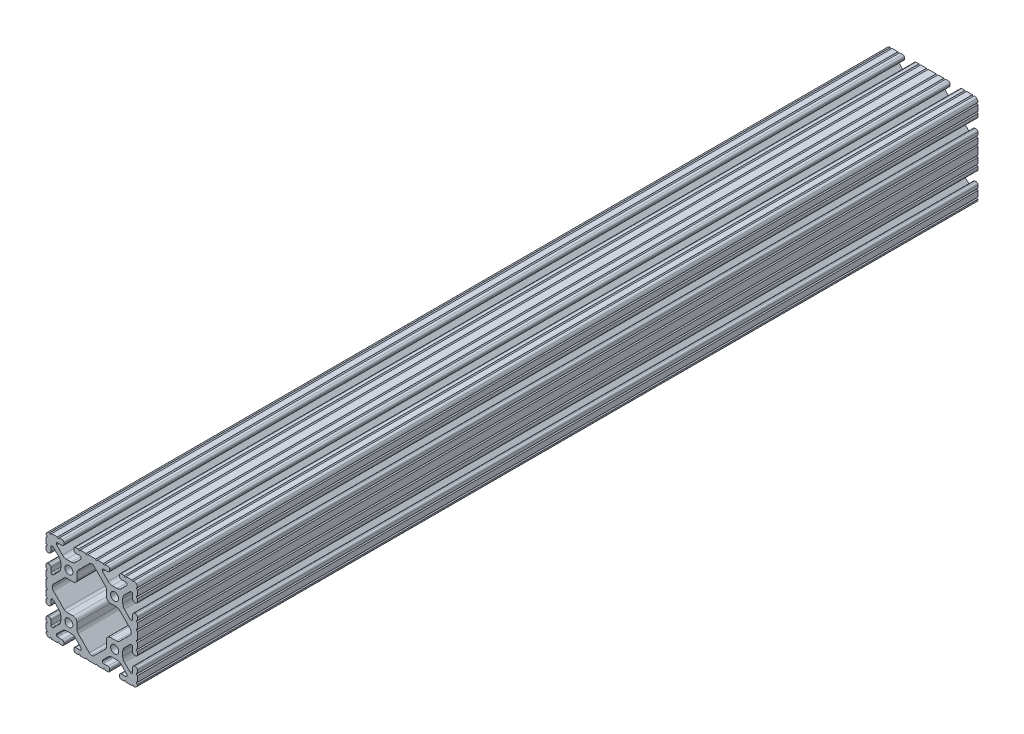
from build123d import *

# Parameters (mm, degrees)
BOSS_EXTRUDE1_DEPTH      = 350
BOSS_EXTRUDE1_DEPTH_BACK = 350
SKETCH3_R                = 3.3274


with BuildPart() as part:
    # Sketch3 → Boss-Extrude1 (new, two sides: drawn at the far end of the back side and taken through both)
    with BuildSketch(Plane.XY.offset(-BOSS_EXTRUDE1_DEPTH_BACK)):
        with BuildLine():
            Line((34.036, 28.448), (34.036, 24.630196049))
            ThreePointArc((34.036, 24.630196049), (34.497248241, 23.51664429), (35.6108, 23.055396049))
            Line((35.6108, 23.055396049), (36.525200183, 23.055396049))
            ThreePointArc((36.525200183, 23.055396049), (37.638751813, 23.516644236), (38.1, 24.630195866))
            Line((38.1, 24.630195866), (38.1, 27.023826138))
            ThreePointArc((38.1, 27.023826138), (37.117780706, 27.7845421), (38.1, 28.545258062))
            Line((38.1, 28.545258062), (38.1, 33.373016026))
            ThreePointArc((38.1, 33.373016026), (37.141472621, 34.109236774), (38.1, 34.845457521))
            ThreePointArc((38.1, 34.845457521), (37.837757813, 36.120195002), (37.086123144, 37.182631793))
            ThreePointArc((37.086123144, 37.182631793), (36.106286572, 37.843374398), (34.952681874, 38.1))
            ThreePointArc((34.952681874, 38.1), (34.190730434, 37.320215335), (33.428778994, 38.1))
            Line((33.428778994, 38.1), (28.601105935, 38.1))
            ThreePointArc((28.601105935, 38.1), (27.839158581, 37.32021942), (27.077211227, 38.1))
            Line((27.077211227, 38.1), (24.6888, 38.1))
            ThreePointArc((24.6888, 38.1), (23.575248241, 37.638751759), (23.114, 36.5252))
            Line((23.114, 36.5252), (23.114, 35.6108))
            ThreePointArc((23.114, 35.6108), (23.575248241, 34.497248241), (24.6888, 34.036))
            Line((24.6888, 34.036), (28.448, 34.036))
            ThreePointArc((28.448, 34.036), (29.076617928, 33.775617928), (29.337, 33.147))
            Line((29.337, 33.147), (29.337, 32.720693454))
            ThreePointArc((29.337, 32.720693454), (29.326675076, 32.273872751), (29.100231244, 31.888543625))
            Line((29.100231244, 31.888543625), (24.409287499, 27.197588341))
            ThreePointArc((24.409287499, 27.197588341), (22.868340045, 26.167958114), (21.050667579, 25.8064))
            Line((21.050667579, 25.8064), (17.049332421, 25.8064))
            ThreePointArc((17.049332421, 25.8064), (15.231659955, 26.167958114), (13.690712501, 27.197588341))
            Line((13.690712501, 27.197588341), (9.023381298, 31.864931024))
            ThreePointArc((9.023381298, 31.864931024), (8.830670886, 32.153343113), (8.763, 32.493548179))
            Line((8.763, 32.493548179), (8.763, 33.147))
            ThreePointArc((8.763, 33.147), (9.023382072, 33.775617928), (9.652, 34.036))
            Line((9.652, 34.036), (13.4112, 34.036))
            ThreePointArc((13.4112, 34.036), (14.524751759, 34.497248241), (14.986, 35.6108))
            Line((14.986, 35.6108), (14.986, 36.5252))
            ThreePointArc((14.986, 36.5252), (14.524751759, 37.638751759), (13.4112, 38.1))
            Line((13.4112, 38.1), (11.128867074, 38.1))
            ThreePointArc((11.128867074, 38.1), (10.367071033, 37.320370693), (9.605274992, 38.1))
            Line((9.605274992, 38.1), (4.777313069, 38.1))
            ThreePointArc((4.777313069, 38.1), (4.015517029, 37.320370693), (3.253720988, 38.1))
            Line((3.253720988, 38.1), (-3.253720988, 38.1))
            ThreePointArc((-3.253720988, 38.1), (-4.015517029, 37.320370693), (-4.777313069, 38.1))
            Line((-4.777313069, 38.1), (-9.605274992, 38.1))
            ThreePointArc((-9.605274992, 38.1), (-10.367071033, 37.320370693), (-11.128867074, 38.1))
            Line((-11.128867074, 38.1), (-13.4112, 38.1))
            ThreePointArc((-13.4112, 38.1), (-14.524751759, 37.638751759), (-14.986, 36.5252))
            Line((-14.986, 36.5252), (-14.986, 35.6108))
            ThreePointArc((-14.986, 35.6108), (-14.524751759, 34.497248241), (-13.4112, 34.036))
            Line((-13.4112, 34.036), (-9.652, 34.036))
            ThreePointArc((-9.652, 34.036), (-9.023382072, 33.775617928), (-8.763, 33.147))
            Line((-8.763, 33.147), (-8.763, 32.493548179))
            ThreePointArc((-8.763, 32.493548179), (-8.830670886, 32.153343113), (-9.023381298, 31.864931024))
            Line((-9.023381298, 31.864931024), (-13.690712501, 27.197588341))
            ThreePointArc((-13.690712501, 27.197588341), (-15.231659955, 26.167958114), (-17.049332421, 25.8064))
            Line((-17.049332421, 25.8064), (-21.050667579, 25.8064))
            ThreePointArc((-21.050667579, 25.8064), (-22.868340045, 26.167958114), (-24.409287499, 27.197588341))
            Line((-24.409287499, 27.197588341), (-29.100231244, 31.888543625))
            ThreePointArc((-29.100231244, 31.888543625), (-29.326675076, 32.273872751), (-29.337, 32.720693454))
            Line((-29.337, 32.720693454), (-29.337, 33.147))
            ThreePointArc((-29.337, 33.147), (-29.076617928, 33.775617928), (-28.448, 34.036))
            Line((-28.448, 34.036), (-24.6888, 34.036))
            ThreePointArc((-24.6888, 34.036), (-23.575248241, 34.497248241), (-23.114, 35.6108))
            Line((-23.114, 35.6108), (-23.114, 36.5252))
            ThreePointArc((-23.114, 36.5252), (-23.575248241, 37.638751759), (-24.6888, 38.1))
            Line((-24.6888, 38.1), (-27.077211227, 38.1))
            ThreePointArc((-27.077211227, 38.1), (-27.839158581, 37.32021942), (-28.601105935, 38.1))
            Line((-28.601105935, 38.1), (-33.428778994, 38.1))
            ThreePointArc((-33.428778994, 38.1), (-34.190730434, 37.320215335), (-34.952681874, 38.1))
            ThreePointArc((-34.952681874, 38.1), (-36.106286572, 37.843374398), (-37.086123144, 37.182631793))
            ThreePointArc((-37.086123144, 37.182631793), (-37.837757813, 36.120195002), (-38.1, 34.845457521))
            ThreePointArc((-38.1, 34.845457521), (-37.141472621, 34.109236774), (-38.1, 33.373016026))
            Line((-38.1, 33.373016026), (-38.1, 28.545258062))
            ThreePointArc((-38.1, 28.545258062), (-37.117780706, 27.7845421), (-38.1, 27.023826138))
            Line((-38.1, 27.023826138), (-38.1, 24.630195866))
            ThreePointArc((-38.1, 24.630195866), (-37.638751813, 23.516644236), (-36.525200183, 23.055396049))
            Line((-36.525200183, 23.055396049), (-35.6108, 23.055396049))
            ThreePointArc((-35.6108, 23.055396049), (-34.497248241, 23.51664429), (-34.036, 24.630196049))
            Line((-34.036, 24.630196049), (-34.036, 28.448))
            ThreePointArc((-34.036, 28.448), (-33.775617928, 29.076617928), (-33.147, 29.337))
            Line((-33.147, 29.337), (-32.664287242, 29.337))
            ThreePointArc((-32.664287242, 29.337), (-32.324081166, 29.269328695), (-32.03566854, 29.076617155))
            Line((-32.03566854, 29.076617155), (-27.19758008, 24.238516795))
            ThreePointArc((-27.19758008, 24.238516795), (-26.167955879, 22.697572205), (-25.8064, 20.879905136))
            Line((-25.8064, 20.879905136), (-25.8064, 17.220094864))
            ThreePointArc((-25.8064, 17.220094864), (-26.167955879, 15.402427795), (-27.19758008, 13.861483205))
            Line((-27.19758008, 13.861483205), (-31.948944541, 9.110107057))
            ThreePointArc((-31.948944541, 9.110107057), (-32.333417096, 8.853210196), (-32.786933649, 8.763))
            Line((-32.786933649, 8.763), (-33.060275787, 8.763))
            ThreePointArc((-33.060275787, 8.763), (-33.750216995, 9.048783005), (-34.036, 9.738724213))
            Line((-34.036, 9.738724213), (-34.036, 13.469803585))
            ThreePointArc((-34.036, 13.469803585), (-34.497248348, 14.583355603), (-35.610800366, 15.044603951))
            Line((-35.610800366, 15.044603951), (-36.5252, 15.044603951))
            ThreePointArc((-36.5252, 15.044603951), (-37.638751759, 14.58335571), (-38.1, 13.469803951))
            Line((-38.1, 13.469803951), (-38.1, 11.075039289))
            ThreePointArc((-38.1, 11.075039289), (-37.117000248, 10.313517272), (-38.1, 9.551995255))
            Line((-38.1, 9.551995255), (-38.1, 4.723759308))
            ThreePointArc((-38.1, 4.723759308), (-37.117000248, 3.962237292), (-38.1, 3.200715275))
            Line((-38.1, 3.200715275), (-38.1, -3.200715275))
            ThreePointArc((-38.1, -3.200715275), (-37.117000248, -3.962237292), (-38.1, -4.723759308))
            Line((-38.1, -4.723759308), (-38.1, -9.551995255))
            ThreePointArc((-38.1, -9.551995255), (-37.117000248, -10.313517272), (-38.1, -11.075039289))
            Line((-38.1, -11.075039289), (-38.1, -13.469803951))
            ThreePointArc((-38.1, -13.469803951), (-37.638751759, -14.58335571), (-36.5252, -15.044603951))
            Line((-36.5252, -15.044603951), (-35.610800366, -15.044603951))
            ThreePointArc((-35.610800366, -15.044603951), (-34.497248348, -14.583355603), (-34.036, -13.469803585))
            Line((-34.036, -13.469803585), (-34.036, -9.738724213))
            ThreePointArc((-34.036, -9.738724213), (-33.750216995, -9.048783005), (-33.060275787, -8.763))
            Line((-33.060275787, -8.763), (-32.786933649, -8.763))
            ThreePointArc((-32.786933649, -8.763), (-32.333417096, -8.853210196), (-31.948944541, -9.110107057))
            Line((-31.948944541, -9.110107057), (-27.19758008, -13.861483205))
            ThreePointArc((-27.19758008, -13.861483205), (-26.167955879, -15.402427795), (-25.8064, -17.220094864))
            Line((-25.8064, -17.220094864), (-25.8064, -20.879905136))
            ThreePointArc((-25.8064, -20.879905136), (-26.167955879, -22.697572205), (-27.19758008, -24.238516795))
            Line((-27.19758008, -24.238516795), (-32.03566854, -29.076617155))
            ThreePointArc((-32.03566854, -29.076617155), (-32.324081166, -29.269328695), (-32.664287242, -29.337))
            Line((-32.664287242, -29.337), (-33.147, -29.337))
            ThreePointArc((-33.147, -29.337), (-33.775617928, -29.076617928), (-34.036, -28.448))
            Line((-34.036, -28.448), (-34.036, -24.630196049))
            ThreePointArc((-34.036, -24.630196049), (-34.497248241, -23.51664429), (-35.6108, -23.055396049))
            Line((-35.6108, -23.055396049), (-36.525200183, -23.055396049))
            ThreePointArc((-36.525200183, -23.055396049), (-37.638751813, -23.516644236), (-38.1, -24.630195866))
            Line((-38.1, -24.630195866), (-38.1, -27.023826138))
            ThreePointArc((-38.1, -27.023826138), (-37.117780706, -27.7845421), (-38.1, -28.545258062))
            Line((-38.1, -28.545258062), (-38.1, -33.373016026))
            ThreePointArc((-38.1, -33.373016026), (-37.141472621, -34.109236774), (-38.1, -34.845457521))
            ThreePointArc((-38.1, -34.845457521), (-37.837757813, -36.120195002), (-37.086123144, -37.182631793))
            ThreePointArc((-37.086123144, -37.182631793), (-36.106286572, -37.843374398), (-34.952681874, -38.1))
            ThreePointArc((-34.952681874, -38.1), (-34.190730434, -37.320215335), (-33.428778994, -38.1))
            Line((-33.428778994, -38.1), (-28.601105935, -38.1))
            ThreePointArc((-28.601105935, -38.1), (-27.839158581, -37.32021942), (-27.077211227, -38.1))
            Line((-27.077211227, -38.1), (-24.6888, -38.1))
            ThreePointArc((-24.6888, -38.1), (-23.575248241, -37.638751759), (-23.114, -36.5252))
            Line((-23.114, -36.5252), (-23.114, -35.6108))
            ThreePointArc((-23.114, -35.6108), (-23.575248241, -34.497248241), (-24.6888, -34.036))
            Line((-24.6888, -34.036), (-28.448, -34.036))
            ThreePointArc((-28.448, -34.036), (-29.076617928, -33.775617928), (-29.337, -33.147))
            Line((-29.337, -33.147), (-29.337, -32.720693454))
            ThreePointArc((-29.337, -32.720693454), (-29.326675076, -32.273872751), (-29.100231244, -31.888543625))
            Line((-29.100231244, -31.888543625), (-24.409287499, -27.197588341))
            ThreePointArc((-24.409287499, -27.197588341), (-22.868340045, -26.167958114), (-21.050667579, -25.8064))
            Line((-21.050667579, -25.8064), (-17.049332421, -25.8064))
            ThreePointArc((-17.049332421, -25.8064), (-15.231659955, -26.167958114), (-13.690712501, -27.197588341))
            Line((-13.690712501, -27.197588341), (-9.023381298, -31.864931024))
            ThreePointArc((-9.023381298, -31.864931024), (-8.830670886, -32.153343113), (-8.763, -32.493548179))
            Line((-8.763, -32.493548179), (-8.763, -33.147))
            ThreePointArc((-8.763, -33.147), (-9.023382072, -33.775617928), (-9.652, -34.036))
            Line((-9.652, -34.036), (-13.4112, -34.036))
            ThreePointArc((-13.4112, -34.036), (-14.524751759, -34.497248241), (-14.986, -35.6108))
            Line((-14.986, -35.6108), (-14.986, -36.5252))
            ThreePointArc((-14.986, -36.5252), (-14.524751759, -37.638751759), (-13.4112, -38.1))
            Line((-13.4112, -38.1), (-11.128867074, -38.1))
            ThreePointArc((-11.128867074, -38.1), (-10.367071033, -37.320370693), (-9.605274992, -38.1))
            Line((-9.605274992, -38.1), (-4.777313069, -38.1))
            ThreePointArc((-4.777313069, -38.1), (-4.015517029, -37.320370693), (-3.253720988, -38.1))
            Line((-3.253720988, -38.1), (3.253720988, -38.1))
            ThreePointArc((3.253720988, -38.1), (4.015517029, -37.320370693), (4.777313069, -38.1))
            Line((4.777313069, -38.1), (9.605274992, -38.1))
            ThreePointArc((9.605274992, -38.1), (10.367071033, -37.320370693), (11.128867074, -38.1))
            Line((11.128867074, -38.1), (13.4112, -38.1))
            ThreePointArc((13.4112, -38.1), (14.524751759, -37.638751759), (14.986, -36.5252))
            Line((14.986, -36.5252), (14.986, -35.6108))
            ThreePointArc((14.986, -35.6108), (14.524751759, -34.497248241), (13.4112, -34.036))
            Line((13.4112, -34.036), (9.652, -34.036))
            ThreePointArc((9.652, -34.036), (9.023382072, -33.775617928), (8.763, -33.147))
            Line((8.763, -33.147), (8.763, -32.493548179))
            ThreePointArc((8.763, -32.493548179), (8.830670886, -32.153343113), (9.023381298, -31.864931024))
            Line((9.023381298, -31.864931024), (13.690712501, -27.197588341))
            ThreePointArc((13.690712501, -27.197588341), (15.231659955, -26.167958114), (17.049332421, -25.8064))
            Line((17.049332421, -25.8064), (21.050667579, -25.8064))
            ThreePointArc((21.050667579, -25.8064), (22.868340045, -26.167958114), (24.409287499, -27.197588341))
            Line((24.409287499, -27.197588341), (29.100231244, -31.888543625))
            ThreePointArc((29.100231244, -31.888543625), (29.326675076, -32.273872751), (29.337, -32.720693454))
            Line((29.337, -32.720693454), (29.337, -33.147))
            ThreePointArc((29.337, -33.147), (29.076617928, -33.775617928), (28.448, -34.036))
            Line((28.448, -34.036), (24.6888, -34.036))
            ThreePointArc((24.6888, -34.036), (23.575248241, -34.497248241), (23.114, -35.6108))
            Line((23.114, -35.6108), (23.114, -36.5252))
            ThreePointArc((23.114, -36.5252), (23.575248241, -37.638751759), (24.6888, -38.1))
            Line((24.6888, -38.1), (27.077211227, -38.1))
            ThreePointArc((27.077211227, -38.1), (27.839158581, -37.32021942), (28.601105935, -38.1))
            Line((28.601105935, -38.1), (33.428778994, -38.1))
            ThreePointArc((33.428778994, -38.1), (34.190730434, -37.320215335), (34.952681874, -38.1))
            ThreePointArc((34.952681874, -38.1), (36.106286572, -37.843374398), (37.086123144, -37.182631793))
            ThreePointArc((37.086123144, -37.182631793), (37.837757813, -36.120195002), (38.1, -34.845457521))
            ThreePointArc((38.1, -34.845457521), (37.141472621, -34.109236774), (38.1, -33.373016026))
            Line((38.1, -33.373016026), (38.1, -28.545258062))
            ThreePointArc((38.1, -28.545258062), (37.117780706, -27.7845421), (38.1, -27.023826138))
            Line((38.1, -27.023826138), (38.1, -24.630195866))
            ThreePointArc((38.1, -24.630195866), (37.638751813, -23.516644236), (36.525200183, -23.055396049))
            Line((36.525200183, -23.055396049), (35.6108, -23.055396049))
            ThreePointArc((35.6108, -23.055396049), (34.497248241, -23.51664429), (34.036, -24.630196049))
            Line((34.036, -24.630196049), (34.036, -28.448))
            ThreePointArc((34.036, -28.448), (33.775617928, -29.076617928), (33.147, -29.337))
            Line((33.147, -29.337), (32.664287242, -29.337))
            ThreePointArc((32.664287242, -29.337), (32.324081166, -29.269328695), (32.03566854, -29.076617155))
            Line((32.03566854, -29.076617155), (27.19758008, -24.238516795))
            ThreePointArc((27.19758008, -24.238516795), (26.167955879, -22.697572205), (25.8064, -20.879905136))
            Line((25.8064, -20.879905136), (25.8064, -17.220094864))
            ThreePointArc((25.8064, -17.220094864), (26.167955879, -15.402427795), (27.19758008, -13.861483205))
            Line((27.19758008, -13.861483205), (31.948944541, -9.110107057))
            ThreePointArc((31.948944541, -9.110107057), (32.333417096, -8.853210196), (32.786933649, -8.763))
            Line((32.786933649, -8.763), (33.060275787, -8.763))
            ThreePointArc((33.060275787, -8.763), (33.750216995, -9.048783005), (34.036, -9.738724213))
            Line((34.036, -9.738724213), (34.036, -13.469803585))
            ThreePointArc((34.036, -13.469803585), (34.497248348, -14.583355603), (35.610800366, -15.044603951))
            Line((35.610800366, -15.044603951), (36.5252, -15.044603951))
            ThreePointArc((36.5252, -15.044603951), (37.638751759, -14.58335571), (38.1, -13.469803951))
            Line((38.1, -13.469803951), (38.1, -11.075039289))
            ThreePointArc((38.1, -11.075039289), (37.117000248, -10.313517272), (38.1, -9.551995255))
            Line((38.1, -9.551995255), (38.1, -4.723759308))
            ThreePointArc((38.1, -4.723759308), (37.117000248, -3.962237292), (38.1, -3.200715275))
            Line((38.1, -3.200715275), (38.1, 3.200715275))
            ThreePointArc((38.1, 3.200715275), (37.117000248, 3.962237292), (38.1, 4.723759308))
            Line((38.1, 4.723759308), (38.1, 9.551995255))
            ThreePointArc((38.1, 9.551995255), (37.117000248, 10.313517272), (38.1, 11.075039289))
            Line((38.1, 11.075039289), (38.1, 13.469803951))
            ThreePointArc((38.1, 13.469803951), (37.638751759, 14.58335571), (36.5252, 15.044603951))
            Line((36.5252, 15.044603951), (35.610800366, 15.044603951))
            ThreePointArc((35.610800366, 15.044603951), (34.497248348, 14.583355603), (34.036, 13.469803585))
            Line((34.036, 13.469803585), (34.036, 9.738724213))
            ThreePointArc((34.036, 9.738724213), (33.750216995, 9.048783005), (33.060275787, 8.763))
            Line((33.060275787, 8.763), (32.786933649, 8.763))
            ThreePointArc((32.786933649, 8.763), (32.333417096, 8.853210196), (31.948944541, 9.110107057))
            Line((31.948944541, 9.110107057), (27.19758008, 13.861483205))
            ThreePointArc((27.19758008, 13.861483205), (26.167955879, 15.402427795), (25.8064, 17.220094864))
            Line((25.8064, 17.220094864), (25.8064, 20.879905136))
            ThreePointArc((25.8064, 20.879905136), (26.167955879, 22.697572205), (27.19758008, 24.238516795))
            Line((27.19758008, 24.238516795), (32.03566854, 29.076617155))
            ThreePointArc((32.03566854, 29.076617155), (32.324081166, 29.269328695), (32.664287242, 29.337))
            Line((32.664287242, 29.337), (33.147, 29.337))
            ThreePointArc((33.147, 29.337), (33.775617928, 29.076617928), (34.036, 28.448))
        make_face()
        with Locations((19.05, 19.05)):
            Circle(SKETCH3_R, mode=Mode.SUBTRACT)
        with Locations((-19.05, 19.05)):
            Circle(SKETCH3_R, mode=Mode.SUBTRACT)
        with Locations((19.05, -19.05)):
            Circle(SKETCH3_R, mode=Mode.SUBTRACT)
        with Locations((-19.05, -19.05)):
            Circle(SKETCH3_R, mode=Mode.SUBTRACT)
        with BuildLine():
            Line((-11.363666791, -22.843321003), (-2.051515952, -32.155494748))
            ThreePointArc((-2.051515952, -32.155494748), (-1.11031328, -32.786013752), (0, -33.011005091))
            ThreePointArc((0, -33.011005091), (1.11031328, -32.786013752), (2.051515952, -32.155494748))
            Line((2.051515952, -32.155494748), (11.363666791, -22.843321003))
            ThreePointArc((11.363666791, -22.843321003), (12.051918263, -21.813277828), (12.2936, -20.598259734))
            Line((12.2936, -20.598259734), (12.2936, -15.4686))
            ThreePointArc((12.2936, -15.4686), (13.22353597, -13.22353597), (15.4686, -12.2936))
            Line((15.4686, -12.2936), (20.769026744, -12.2936))
            ThreePointArc((20.769026744, -12.2936), (21.984048446, -12.051916769), (23.014093535, -11.363661269))
            Line((23.014093535, -11.363661269), (31.902125566, -2.475607377))
            ThreePointArc((31.902125566, -2.475607377), (32.607298578, -1.335259481), (32.728725173, 0))
            ThreePointArc((32.728725173, 0), (32.607298578, 1.335259481), (31.902125566, 2.475607377))
            Line((31.902125566, 2.475607377), (23.014093535, 11.363661269))
            ThreePointArc((23.014093535, 11.363661269), (21.984048446, 12.051916769), (20.769026744, 12.2936))
            Line((20.769026744, 12.2936), (15.4686, 12.2936))
            ThreePointArc((15.4686, 12.2936), (13.22353597, 13.22353597), (12.2936, 15.4686))
            Line((12.2936, 15.4686), (12.2936, 20.598259734))
            ThreePointArc((12.2936, 20.598259734), (12.051918263, 21.813277828), (11.363666791, 22.843321003))
            Line((11.363666791, 22.843321003), (2.051515952, 32.155494748))
            ThreePointArc((2.051515952, 32.155494748), (1.11031328, 32.786013752), (0, 33.011005091))
            ThreePointArc((0, 33.011005091), (-1.11031328, 32.786013752), (-2.051515952, 32.155494748))
            Line((-2.051515952, 32.155494748), (-11.363666791, 22.843321003))
            ThreePointArc((-11.363666791, 22.843321003), (-12.051918263, 21.813277828), (-12.2936, 20.598259734))
            Line((-12.2936, 20.598259734), (-12.2936, 15.4686))
            ThreePointArc((-12.2936, 15.4686), (-13.22353597, 13.22353597), (-15.4686, 12.2936))
            Line((-15.4686, 12.2936), (-20.769026744, 12.2936))
            ThreePointArc((-20.769026744, 12.2936), (-21.984048446, 12.051916769), (-23.014093535, 11.363661269))
            Line((-23.014093535, 11.363661269), (-31.902125566, 2.475607377))
            ThreePointArc((-31.902125566, 2.475607377), (-32.607298578, 1.335259481), (-32.728725173, 0))
            ThreePointArc((-32.728725173, 0), (-32.607298578, -1.335259481), (-31.902125566, -2.475607377))
            Line((-31.902125566, -2.475607377), (-23.014093535, -11.363661269))
            ThreePointArc((-23.014093535, -11.363661269), (-21.984048446, -12.051916769), (-20.769026744, -12.2936))
            Line((-20.769026744, -12.2936), (-15.4686, -12.2936))
            ThreePointArc((-15.4686, -12.2936), (-13.22353597, -13.22353597), (-12.2936, -15.4686))
            Line((-12.2936, -15.4686), (-12.2936, -20.598259734))
            ThreePointArc((-12.2936, -20.598259734), (-12.051918263, -21.813277828), (-11.363666791, -22.843321003))
        make_face(mode=Mode.SUBTRACT)
    extrude(amount=BOSS_EXTRUDE1_DEPTH + BOSS_EXTRUDE1_DEPTH_BACK)


solid = part.part
